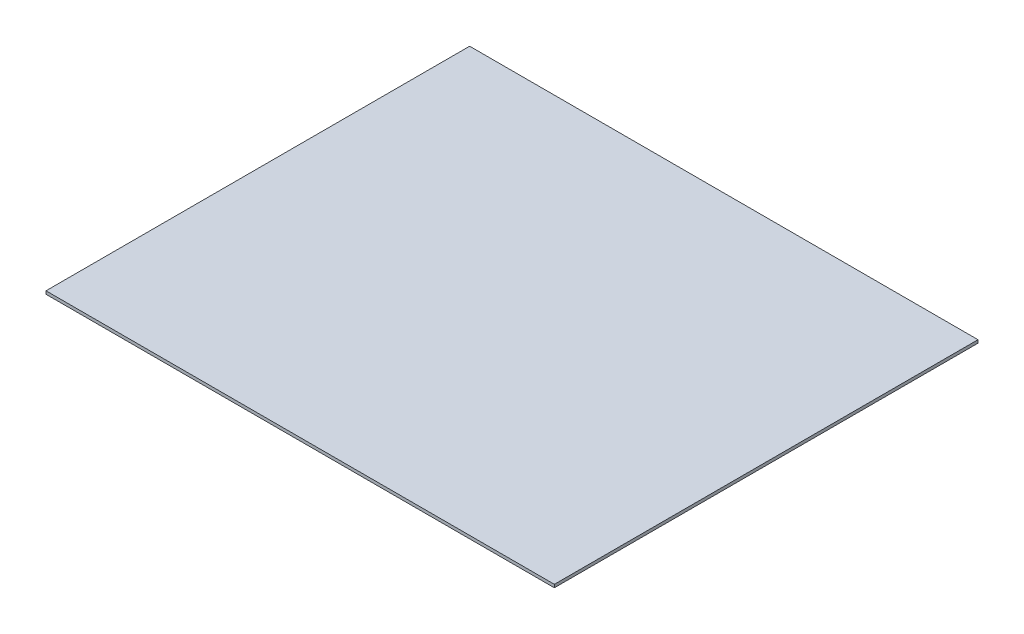
from build123d import *

# Parameters (mm, degrees)
SKETCH1_W           = 152.4
SKETCH1_H           = 127
BOSS_EXTRUDE1_DEPTH = 0.91186


with BuildPart() as part:
    # Sketch1 → Boss-Extrude1 (new body)
    with BuildSketch(Plane(origin=(0, 0, 0), x_dir=(1, 0, 0), z_dir=(0, 1, 0))):
        with Locations((76.2, 63.5)):
            Rectangle(SKETCH1_W, SKETCH1_H)
    extrude(amount=BOSS_EXTRUDE1_DEPTH)


solid = part.part
